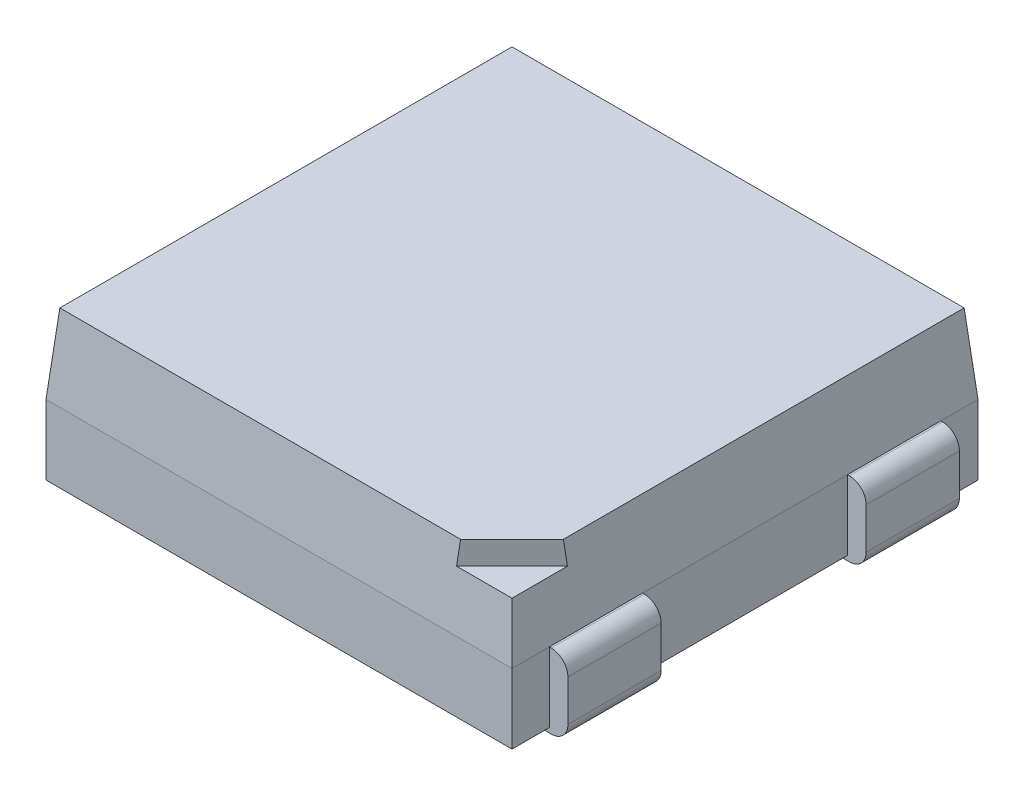
from build123d import *

# Parameters (mm, degrees)
SKETCH1_W                       = 0.8
SKETCH1_H                       = 1
BOSS_EXTRUDE1_DEPTH             = 0.75
BOSS_EXTRUDE3_REACH             = 9.253
SKETCH1_4_W                     = 0.2
SKETCH1_4_H                     = 1
SKETCH1_4_W_2                   = 0.8
BOSS_EXTRUDE3_DIRECTION_2_DEPTH = 0.05
FILLET2_R                       = 0.18
BOSS_EXTRUDE2_DEPTH             = 0.85
BOSS_EXTRUDE2_TAPER             = 5
CUT_EXTRUDE1_START              = 0.6
CUT_EXTRUDE1_DEPTH              = 0.25


with BuildPart() as part:
    # Sketch1 → Boss-Extrude1 (new body)
    with BuildSketch(Plane(origin=(0, 0, 0), x_dir=(1, 0, 0), z_dir=(0, 1, 0))):
        Polygon((5.2, 4.6), (5.2, 5), (0.2, 5), (0.2, 4.6), (1, 4.6), (1, 3.6), (0.2, 3.6), (0.2, 1.4), (1, 1.4), (1, 0.4), (0.2, 0.4), (0.2, 0), (5.2, 0), (5.2, 0.4), (4.4, 0.4), (4.4, 1.4), (5.2, 1.4), (5.2, 3.6), (4.4, 3.6), (4.4, 4.6), align=None)
        with Locations((0.6, 4.1)):
            Rectangle(SKETCH1_W, SKETCH1_H)
        with Locations((4.8, 4.1)):
            Rectangle(SKETCH1_W, SKETCH1_H)
        with Locations((4.8, 0.9)):
            Rectangle(SKETCH1_W, SKETCH1_H)
        with Locations((0.6, 0.9)):
            Rectangle(SKETCH1_W, SKETCH1_H)
    extrude(amount=BOSS_EXTRUDE1_DEPTH)

    # Boss-Extrude3: up to this face of the body (flat: up to its plane)
    boss_extrude3_end = Plane(part.part.faces().sort_by_distance((2.7, 0.75, -2.5))[0])
    # Sketch1<4> → Boss-Extrude3 (add, up to the picked face)
    with BuildSketch(Plane(origin=(0, 0, 0), x_dir=(1, 0, 0), z_dir=(0, 1, 0)), mode=Mode.PRIVATE) as boss_extrude3_sk1:
        with Locations((0.1, 0.9)):
            Rectangle(SKETCH1_4_W, SKETCH1_4_H)
    boss_extrude3_tool1 = split(extrude(boss_extrude3_sk1.sketch, amount=BOSS_EXTRUDE3_REACH, mode=Mode.PRIVATE), bisect_by=boss_extrude3_end, keep=Keep.BOTH, mode=Mode.PRIVATE)
    # Sketch1<4> → Boss-Extrude3 (add, up to the picked face)
    with BuildSketch(Plane(origin=(0, 0, 0), x_dir=(1, 0, 0), z_dir=(0, 1, 0)), mode=Mode.PRIVATE) as boss_extrude3_sk2:
        with Locations((0.6, 0.9)):
            Rectangle(SKETCH1_4_W_2, SKETCH1_4_H)
    boss_extrude3_tool2 = split(extrude(boss_extrude3_sk2.sketch, amount=BOSS_EXTRUDE3_REACH, mode=Mode.PRIVATE), bisect_by=boss_extrude3_end, keep=Keep.BOTH, mode=Mode.PRIVATE)
    # Sketch1<4> → Boss-Extrude3 (add, up to the picked face)
    with BuildSketch(Plane(origin=(0, 0, 0), x_dir=(1, 0, 0), z_dir=(0, 1, 0)), mode=Mode.PRIVATE) as boss_extrude3_sk3:
        with Locations((0.1, 4.1)):
            Rectangle(SKETCH1_4_W, SKETCH1_4_H)
    boss_extrude3_tool3 = split(extrude(boss_extrude3_sk3.sketch, amount=BOSS_EXTRUDE3_REACH, mode=Mode.PRIVATE), bisect_by=boss_extrude3_end, keep=Keep.BOTH, mode=Mode.PRIVATE)
    # Sketch1<4> → Boss-Extrude3 (add, up to the picked face)
    with BuildSketch(Plane(origin=(0, 0, 0), x_dir=(1, 0, 0), z_dir=(0, 1, 0)), mode=Mode.PRIVATE) as boss_extrude3_sk4:
        with Locations((0.6, 4.1)):
            Rectangle(SKETCH1_4_W_2, SKETCH1_4_H)
    boss_extrude3_tool4 = split(extrude(boss_extrude3_sk4.sketch, amount=BOSS_EXTRUDE3_REACH, mode=Mode.PRIVATE), bisect_by=boss_extrude3_end, keep=Keep.BOTH, mode=Mode.PRIVATE)
    # Sketch1<4> → Boss-Extrude3 (add, up to the picked face)
    with BuildSketch(Plane(origin=(0, 0, 0), x_dir=(1, 0, 0), z_dir=(0, 1, 0)), mode=Mode.PRIVATE) as boss_extrude3_sk5:
        with Locations((4.8, 0.9)):
            Rectangle(SKETCH1_4_W_2, SKETCH1_4_H)
    boss_extrude3_tool5 = split(extrude(boss_extrude3_sk5.sketch, amount=BOSS_EXTRUDE3_REACH, mode=Mode.PRIVATE), bisect_by=boss_extrude3_end, keep=Keep.BOTH, mode=Mode.PRIVATE)
    # Sketch1<4> → Boss-Extrude3 (add, up to the picked face)
    with BuildSketch(Plane(origin=(0, 0, 0), x_dir=(1, 0, 0), z_dir=(0, 1, 0)), mode=Mode.PRIVATE) as boss_extrude3_sk6:
        with Locations((5.3, 0.9)):
            Rectangle(SKETCH1_4_W, SKETCH1_4_H)
    boss_extrude3_tool6 = split(extrude(boss_extrude3_sk6.sketch, amount=BOSS_EXTRUDE3_REACH, mode=Mode.PRIVATE), bisect_by=boss_extrude3_end, keep=Keep.BOTH, mode=Mode.PRIVATE)
    # Sketch1<4> → Boss-Extrude3 (add, up to the picked face)
    with BuildSketch(Plane(origin=(0, 0, 0), x_dir=(1, 0, 0), z_dir=(0, 1, 0)), mode=Mode.PRIVATE) as boss_extrude3_sk7:
        with Locations((4.8, 4.1)):
            Rectangle(SKETCH1_4_W_2, SKETCH1_4_H)
    boss_extrude3_tool7 = split(extrude(boss_extrude3_sk7.sketch, amount=BOSS_EXTRUDE3_REACH, mode=Mode.PRIVATE), bisect_by=boss_extrude3_end, keep=Keep.BOTH, mode=Mode.PRIVATE)
    # Sketch1<4> → Boss-Extrude3 (add, up to the picked face)
    with BuildSketch(Plane(origin=(0, 0, 0), x_dir=(1, 0, 0), z_dir=(0, 1, 0)), mode=Mode.PRIVATE) as boss_extrude3_sk8:
        with Locations((5.3, 4.1)):
            Rectangle(SKETCH1_4_W, SKETCH1_4_H)
    boss_extrude3_tool8 = split(extrude(boss_extrude3_sk8.sketch, amount=BOSS_EXTRUDE3_REACH, mode=Mode.PRIVATE), bisect_by=boss_extrude3_end, keep=Keep.BOTH, mode=Mode.PRIVATE)
    add(boss_extrude3_tool1.solids().sort_by(Axis((0.1, 0, -0.9), (0, 1, 0)))[0])
    add(boss_extrude3_tool2.solids().sort_by(Axis((0.6, 0, -0.9), (0, 1, 0)))[0])
    add(boss_extrude3_tool3.solids().sort_by(Axis((0.1, 0, -4.1), (0, 1, 0)))[0])
    add(boss_extrude3_tool4.solids().sort_by(Axis((0.6, 0, -4.1), (0, 1, 0)))[0])
    add(boss_extrude3_tool5.solids().sort_by(Axis((4.8, 0, -0.9), (0, 1, 0)))[0])
    add(boss_extrude3_tool6.solids().sort_by(Axis((5.3, 0, -0.9), (0, 1, 0)))[0])
    add(boss_extrude3_tool7.solids().sort_by(Axis((4.8, 0, -4.1), (0, 1, 0)))[0])
    add(boss_extrude3_tool8.solids().sort_by(Axis((5.3, 0, -4.1), (0, 1, 0)))[0])

    # Sketch1<4> → Boss-Extrude3 direction 2 (add)
    with BuildSketch(Plane(origin=(0, 0, 0), x_dir=(1, 0, 0), z_dir=(0, 1, 0))):
        with Locations((0.1, 0.9)):
            Rectangle(SKETCH1_4_W, SKETCH1_4_H)
        with Locations((0.6, 0.9)):
            Rectangle(SKETCH1_4_W_2, SKETCH1_4_H)
        with Locations((0.1, 4.1)):
            Rectangle(SKETCH1_4_W, SKETCH1_4_H)
        with Locations((0.6, 4.1)):
            Rectangle(SKETCH1_4_W_2, SKETCH1_4_H)
        with Locations((4.8, 0.9)):
            Rectangle(SKETCH1_4_W_2, SKETCH1_4_H)
        with Locations((5.3, 0.9)):
            Rectangle(SKETCH1_4_W, SKETCH1_4_H)
        with Locations((4.8, 4.1)):
            Rectangle(SKETCH1_4_W_2, SKETCH1_4_H)
        with Locations((5.3, 4.1)):
            Rectangle(SKETCH1_4_W, SKETCH1_4_H)
    extrude(amount=-BOSS_EXTRUDE3_DIRECTION_2_DEPTH)

    # Fillet2
    fillet2_edges = [part.edges().sort_by_distance(p)[0] for p in [
        (0, 0.75, -0.9),
        (0, -0.05, -0.9),
        (0, 0.75, -4.1),
        (0, -0.05, -4.1),
        (5.4, -0.05, -0.9),
        (5.4, 0.75, -0.9),
        (5.4, 0.75, -4.1),
        (5.4, -0.05, -4.1),
    ]]
    fillet(fillet2_edges, radius=FILLET2_R)

    # Sketch2 → Boss-Extrude2 (add)
    with BuildSketch(Plane(origin=(0, 0.75, 0), x_dir=(1, 0, 0), z_dir=(0, 1, 0))):
        Polygon((5.2, 1.4), (5.2, 3.6), (5.2, 4.6), (5.2, 5), (0.2, 5), (0.2, 4.6), (0.2, 3.6), (0.2, 1.4), (0.2, 0.4), (0.2, 0), (5.2, 0), (5.2, 0.4), align=None)
    extrude(amount=BOSS_EXTRUDE2_DEPTH, taper=BOSS_EXTRUDE2_TAPER)

    # Sketch4 → Cut-Extrude1 (cut)
    with BuildSketch(Plane(origin=(0, 0.75, 0), x_dir=(1, 0, 0), z_dir=(0, 1, 0)).offset(CUT_EXTRUDE1_START)):
        Polygon((4.5, 0), (5.2, 0.7), (5.2, 0), align=None)
    extrude(amount=CUT_EXTRUDE1_DEPTH, mode=Mode.SUBTRACT)


solid = part.part
